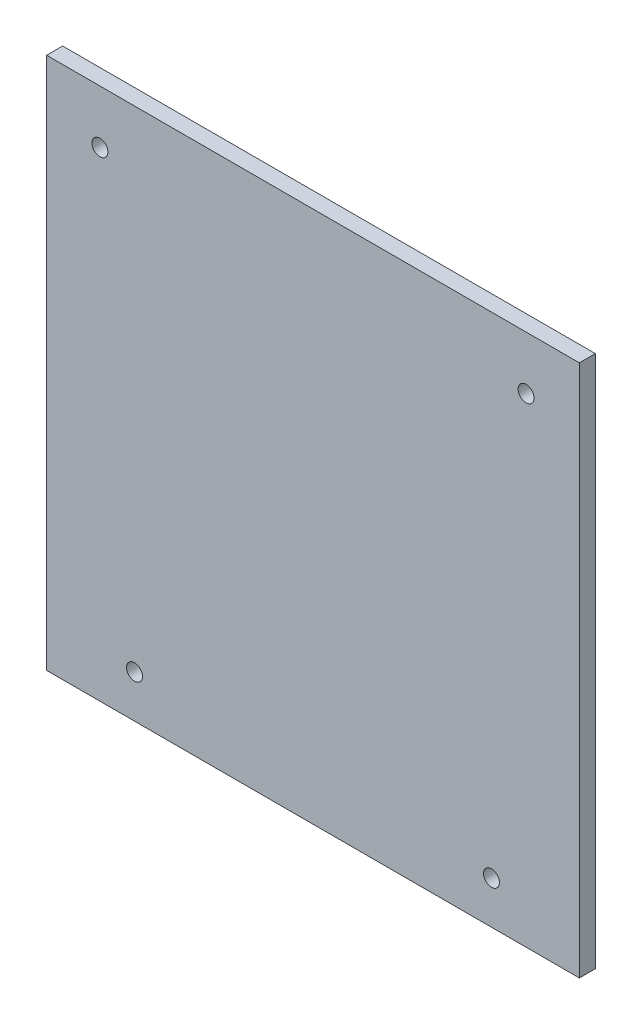
from build123d import *

# Parameters (mm, degrees)
SKETCH1_W           = 100
SKETCH1_H           = 100
BOSS_EXTRUDE1_DEPTH = 3
SKETCH2_R           = 1.5
CUT_EXTRUDE1_DEPTH  = 3


with BuildPart() as part:
    # Sketch1 → Boss-Extrude1 (new body)
    with BuildSketch(Plane.XY):
        Rectangle(SKETCH1_W, SKETCH1_H)
    extrude(amount=BOSS_EXTRUDE1_DEPTH)

    # Sketch2 → Cut-Extrude1 (cut)
    with BuildSketch(Plane.XY.offset(3)):
        with Locations((-40, 40)):
            Circle(SKETCH2_R)
        with Locations((-33.5, -42)):
            Circle(SKETCH2_R)
        with Locations(Location((33.5, -42, 0), (0, 0, 180))):
            Circle(SKETCH2_R)
        with Locations(Location((40, 40, 0), (0, 0, 180))):
            Circle(SKETCH2_R)
    extrude(amount=-CUT_EXTRUDE1_DEPTH, mode=Mode.SUBTRACT)


solid = part.part
